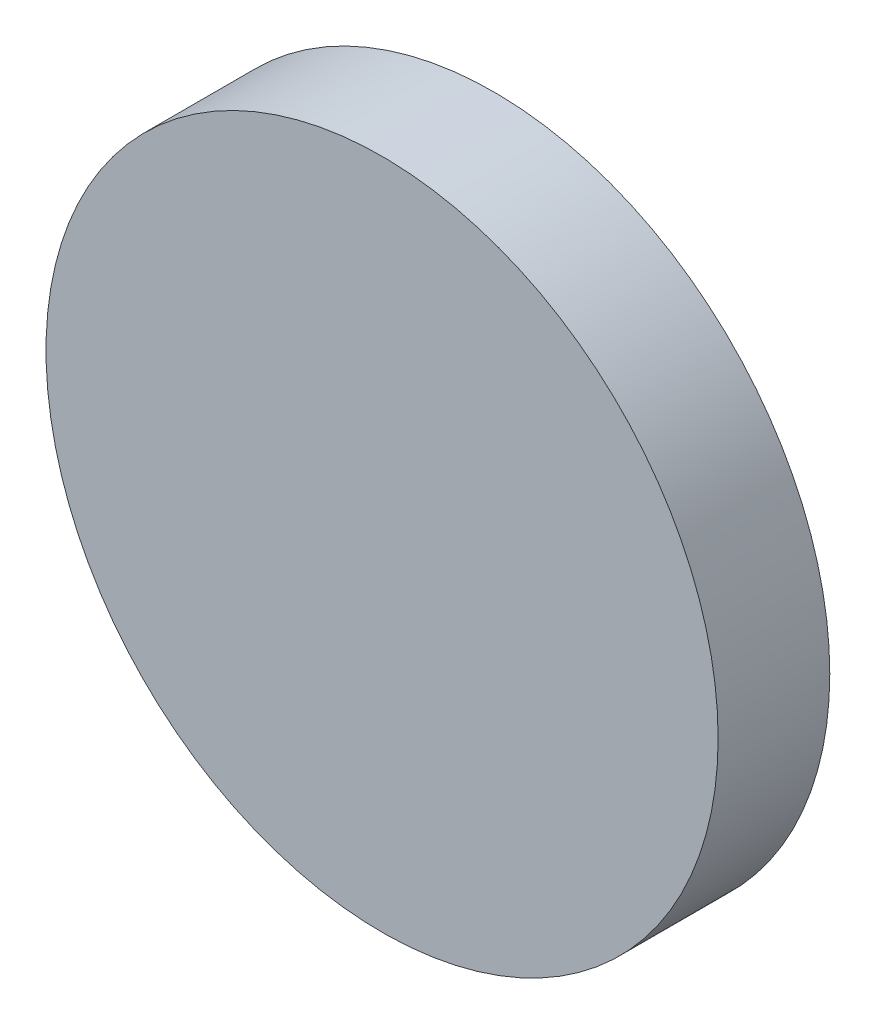
from build123d import *

# Parameters (mm, degrees)
SKETCH1_R           = 30.1
BOSS_EXTRUDE1_DEPTH = 10
SKETCH1_3_R         = 2.5
BOSS_EXTRUDE2_DEPTH = 10


with BuildPart() as part:
    # Sketch1 → Boss-Extrude1 (new body)
    with BuildSketch(Plane.XY):
        Circle(SKETCH1_R)
    extrude(amount=BOSS_EXTRUDE1_DEPTH)

    # Sketch1<3> → Boss-Extrude2 (add)
    with BuildSketch(Plane.XY):
        with Locations((0, 12.5)):
            Circle(SKETCH1_3_R)
        with Locations((-9.013601894, -8.660541605)):
            Circle(SKETCH1_3_R)
        with Locations((9.013601894, -8.660541605)):
            Circle(SKETCH1_3_R)
    extrude(amount=-BOSS_EXTRUDE2_DEPTH)


solid = part.part
